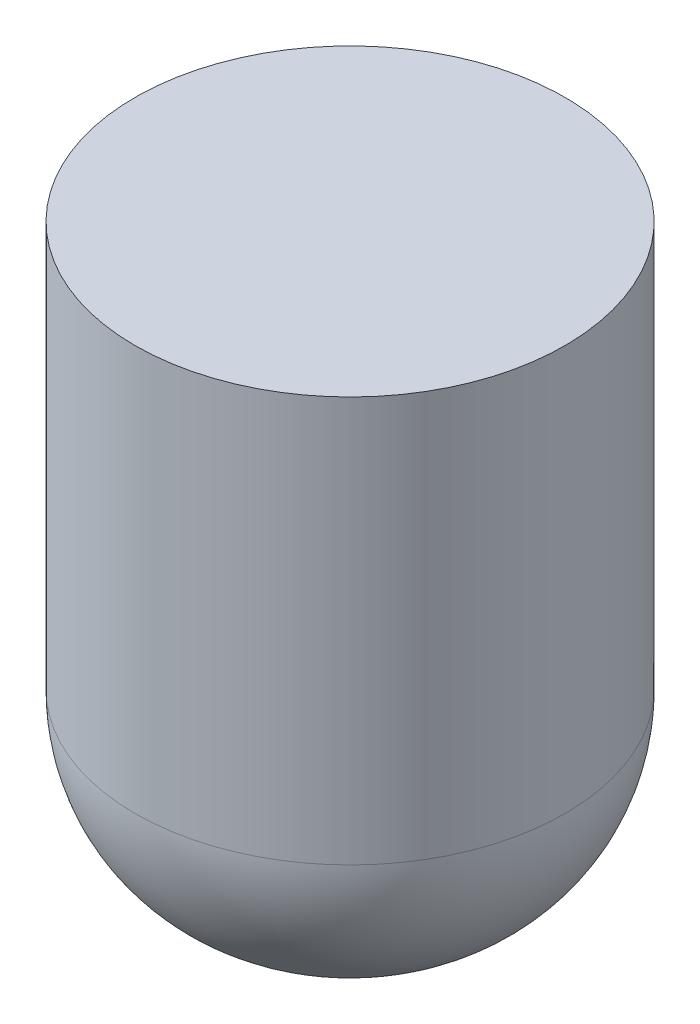
from build123d import *


with BuildPart() as part:
    # Sketch2 → Revolve2 (revolve)
    with BuildSketch(Plane(origin=(0, 0, 0), x_dir=(0, 0, -1), z_dir=(1, 0, 0))):
        with BuildLine():
            Line((0, 0), (-130.175, 0))
            Line((-130.175, 0), (-130.175, -245.388815705))
            ThreePointArc((-130.175, -245.388815705), (-90.893571361, -331.719647513), (0, -358.819496993))
            Line((0, -358.819496993), (0, 0))
        make_face()
    revolve(axis=Axis((0, 0, 0), (0, -1, 0)))


solid = part.part
